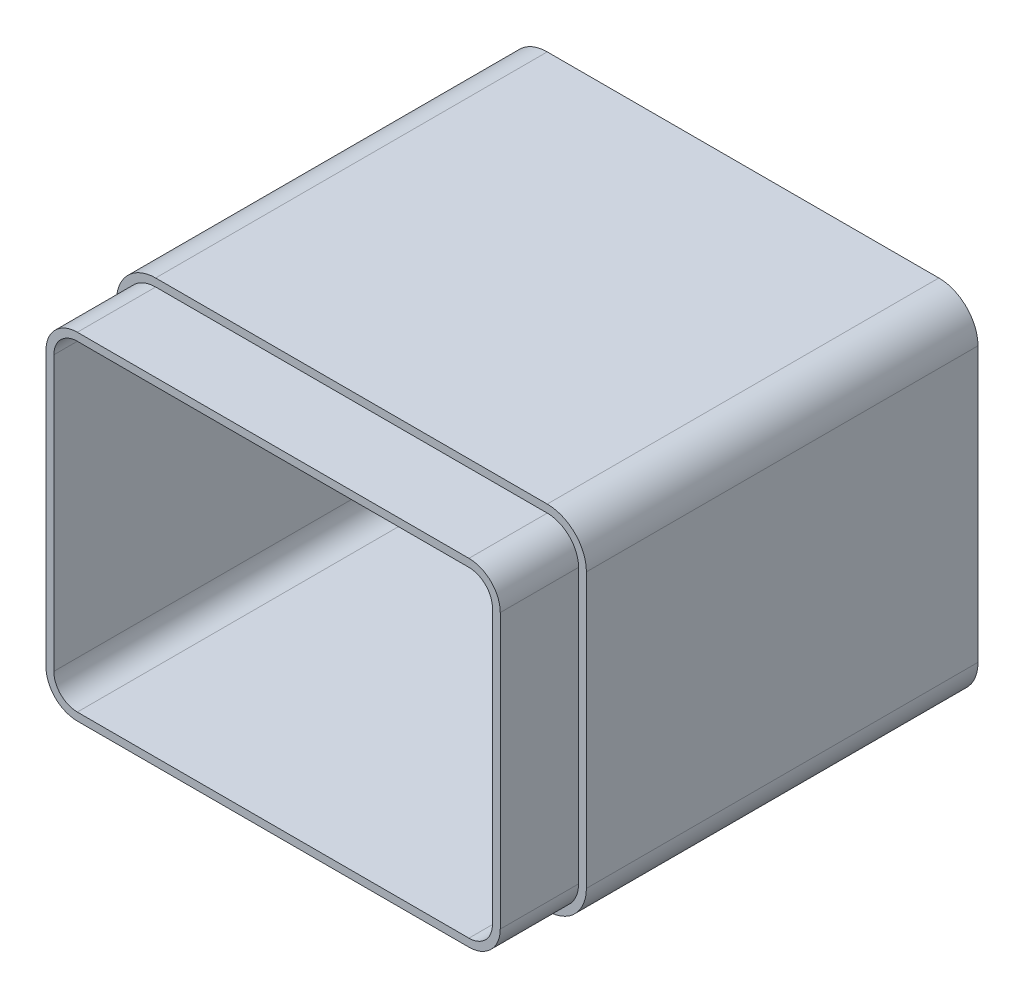
from build123d import *

# Parameters (mm, degrees)
SKETCH2_W           = 3048
SKETCH2_H           = 3048
BOSS_EXTRUDE1_DEPTH = 2286
FILLET1_R           = 254
SHELL1_T            = -101.6
CUT_EXTRUDE1_DEPTH  = 508


with BuildPart() as part:
    # Sketch2 → Boss-Extrude1 (new body)
    with BuildSketch(Plane(origin=(0, 0, 0), x_dir=(1, 0, 0), z_dir=(0, 1, 0))):
        with Locations((1524, 1524)):
            Rectangle(SKETCH2_W, SKETCH2_H)
    extrude(amount=BOSS_EXTRUDE1_DEPTH)

    # Fillet1
    fillet1_edges = [part.edges().sort_by_distance(p)[0] for p in [
        (3048, 2286, -1524),
        (0, 2286, -1524),
        (3048, 0, -1524),
        (0, 0, -1524),
    ]]
    fillet(fillet1_edges, radius=FILLET1_R)

    # Shell1
    shell1_openings = [part.faces().sort_by_distance(p)[0] for p in [
        (1524, 1143, 0),
    ]]
    offset(amount=SHELL1_T, openings=shell1_openings, kind=Kind.INTERSECTION)

    # Sketch4 → Cut-Extrude1 (cut)
    with BuildSketch(Plane.XY):
        with BuildLine():
            Line((3048, 254), (3048, 2032))
            ThreePointArc((3048, 2032), (2973.605122421, 2211.605122421), (2794, 2286))
            Line((2794, 2286), (254, 2286))
            ThreePointArc((254, 2286), (74.394877579, 2211.605122421), (0, 2032))
            Line((0, 2032), (0, 254))
            ThreePointArc((0, 254), (74.394877579, 74.394877579), (254, 0))
            Line((254, 0), (2794, 0))
            ThreePointArc((2794, 0), (2973.605122421, 74.394877579), (3048, 254))
        make_face()
        with BuildLine():
            Line((2997.2, 254), (2997.2, 2032))
            ThreePointArc((2997.2, 2032), (2937.684097937, 2175.684097937), (2794, 2235.2))
            Line((2794, 2235.2), (254, 2235.2))
            ThreePointArc((254, 2235.2), (110.315902063, 2175.684097937), (50.8, 2032))
            Line((50.8, 2032), (50.8, 254))
            ThreePointArc((50.8, 254), (110.315902063, 110.315902063), (254, 50.8))
            Line((254, 50.8), (2794, 50.8))
            ThreePointArc((2794, 50.8), (2937.684097937, 110.315902063), (2997.2, 254))
        make_face(mode=Mode.SUBTRACT)
    extrude(amount=-CUT_EXTRUDE1_DEPTH, mode=Mode.SUBTRACT)


solid = part.part
